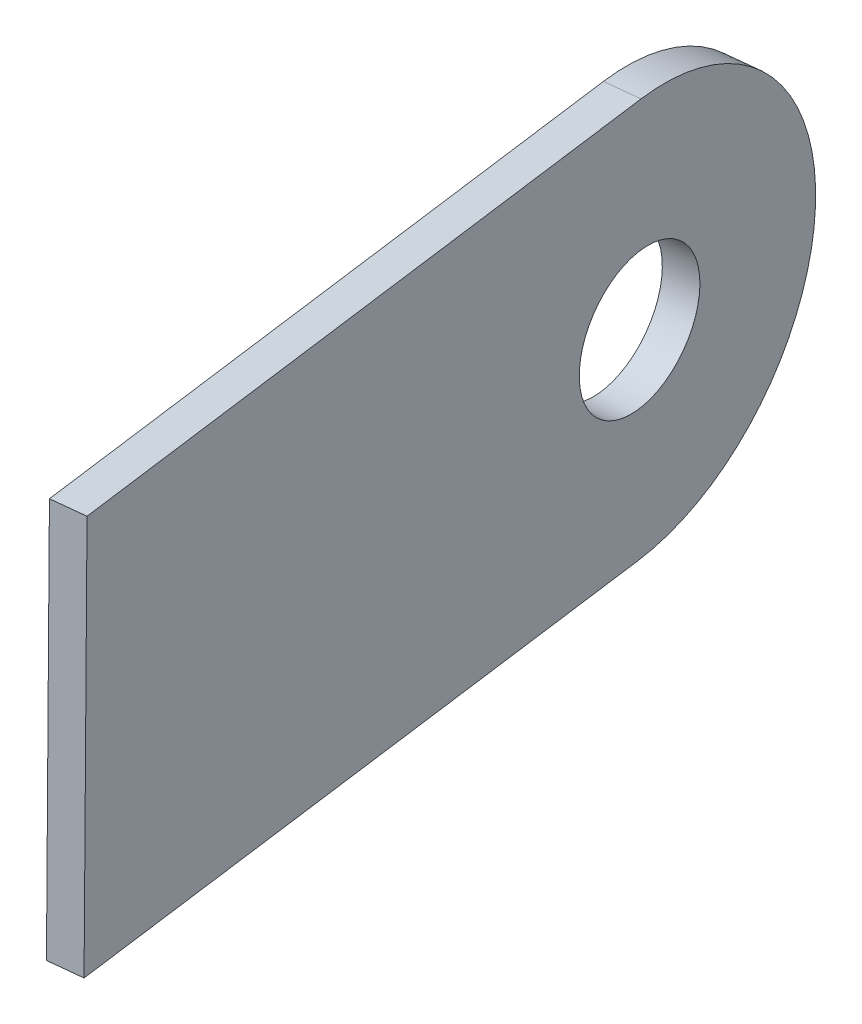
from build123d import *

# Parameters (mm, degrees)
SKETCH2_R           = 3.2639
BOSS_EXTRUDE1_DEPTH = 1.5875


with BuildPart() as part:
    # Sketch2 → Boss-Extrude1 (new body)
    with BuildSketch(Plane(origin=(368.936903679, -5.383850256, -45.587186199), x_dir=(-0.12260510858720207, 0.001789161069619477, -0.9924539214749405), z_dir=(0.9923482658198145, -0.014481214569019532, -0.12261816239453538))):
        with BuildLine():
            Line((479.363760023, 178.345107166), (509.334725416, 178.594140209))
            ThreePointArc((509.334725416, 178.594140209), (518.938538478, 169.148610861), (509.493009129, 159.544797799))
            Line((509.493009129, 159.544797799), (479.522043737, 159.295764756))
            Line((479.522043737, 159.295764756), (479.363760023, 178.345107166))
        make_face()
        with Locations(Location((509.413867272, 169.069469004, 0), (0, 0, 359.897477817))):
            Circle(SKETCH2_R, mode=Mode.SUBTRACT)
    extrude(amount=BOSS_EXTRUDE1_DEPTH)


solid = part.part
